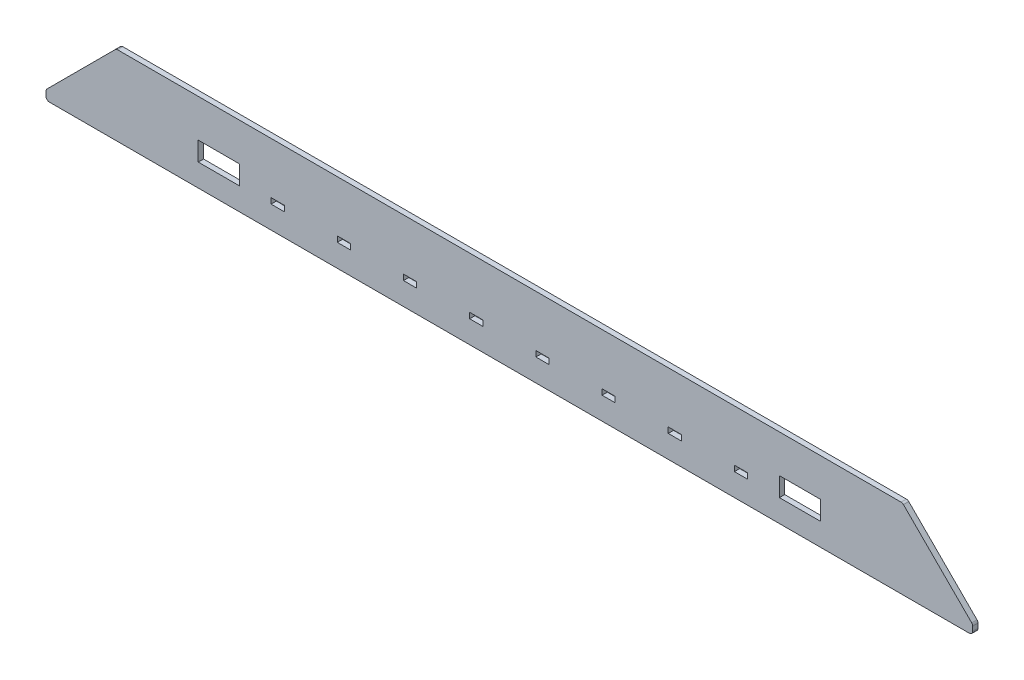
from build123d import *

# Parameters (mm, degrees)
BOSS_EXTRUDE1_DEPTH     = 1.6
FILLET1_R               = 1
BOSS_EXTRUDE2_DEPTH     = 1.6
CUT_EXTRUDE1_DEPTH      = 282.031243815
CUT_EXTRUDE1_DEPTH_BACK = 282.031243815
SKETCH2_W               = 12.4
SKETCH2_H               = 5.75
SKETCH2_W_2             = 3.98
SKETCH2_H_2             = 1.7


with BuildPart() as part:
    # Sketch1 → Boss-Extrude1 (new body)
    with BuildSketch(Plane.XY):
        with BuildLine():
            Line((21.213203436, 24), (0, 2.786796564))
            Line((0, 2.786796564), (0, 0))
            Line((0, 0), (42, 0))
            Line((42, 0), (42, 11))
            ThreePointArc((42, 11), (43.171572875, 13.828427125), (46, 15))
            Line((46, 15), (234, 15))
            ThreePointArc((234, 15), (236.828427125, 13.828427125), (238, 11))
            Line((238, 11), (238, 0))
            Line((238, 0), (280, 0))
            Line((280, 0), (280, 2.786796564))
            Line((280, 2.786796564), (258.786796564, 24))
            Line((258.786796564, 24), (21.213203436, 24))
        make_face()
    extrude(amount=BOSS_EXTRUDE1_DEPTH)

    # Fillet1
    fillet1_edges = [part.edges().sort_by_distance(p)[0] for p in [
        (258.786796564, 24, 0.8),
        (280, 0, 0.8),
        (280, 2.786796564, 0.8),
        (0, 2.786796564, 0.8),
        (0, 0, 0.8),
        (21.213203436, 24, 0.8),
    ]]
    fillet(fillet1_edges, radius=FILLET1_R)

    # Sketch1<3> → Boss-Extrude2 (add)
    with BuildSketch(Plane.XY):
        with BuildLine():
            Line((42, 11), (42, 0))
            Line((42, 0), (238, 0))
            Line((238, 0), (238, 11))
            ThreePointArc((238, 11), (236.828427125, 13.828427125), (234, 15))
            Line((234, 15), (46, 15))
            ThreePointArc((46, 15), (43.171572875, 13.828427125), (42, 11))
        make_face()
    extrude(amount=BOSS_EXTRUDE2_DEPTH)

    # Sketch2 → Cut-Extrude1 (cut, two sides: drawn at the far end of the back side and taken through both)
    with BuildSketch(Plane.XY.offset(-CUT_EXTRUDE1_DEPTH_BACK)):
        with Locations((52.2, 9.675)):
            Rectangle(SKETCH2_W, SKETCH2_H)
        with Locations((90, 7.65)):
            Rectangle(SKETCH2_W_2, SKETCH2_H_2)
        with Locations((70, 7.65)):
            Rectangle(SKETCH2_W_2, SKETCH2_H_2)
        with Locations((227.8, 9.675)):
            Rectangle(SKETCH2_W, SKETCH2_H)
        with Locations((110, 7.65)):
            Rectangle(SKETCH2_W_2, SKETCH2_H_2)
        with Locations((130, 7.65)):
            Rectangle(SKETCH2_W_2, SKETCH2_H_2)
        with Locations((150, 7.65)):
            Rectangle(SKETCH2_W_2, SKETCH2_H_2)
        with Locations((170, 7.65)):
            Rectangle(SKETCH2_W_2, SKETCH2_H_2)
        with Locations((190, 7.65)):
            Rectangle(SKETCH2_W_2, SKETCH2_H_2)
        with Locations((210, 7.65)):
            Rectangle(SKETCH2_W_2, SKETCH2_H_2)
    extrude(amount=CUT_EXTRUDE1_DEPTH + CUT_EXTRUDE1_DEPTH_BACK, mode=Mode.SUBTRACT)


solid = part.part
